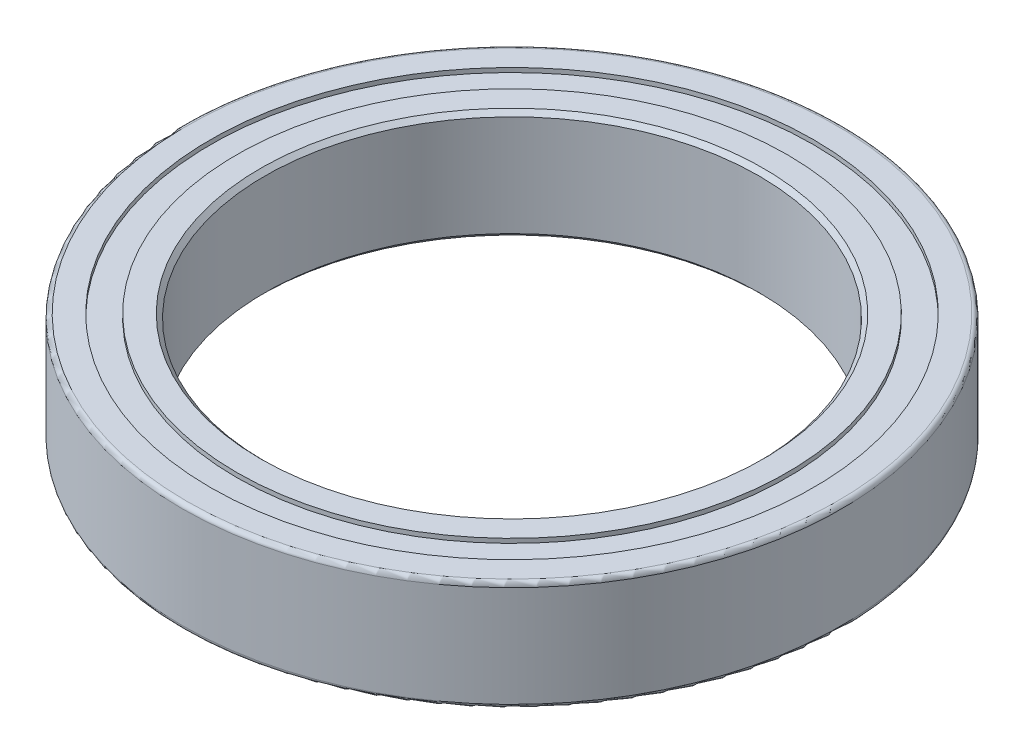
from build123d import *

# Parameters (mm, degrees)
SKETCH1_R             = 9.525
SKETCH1_R_2           = 8.7122
BOSS_EXTRUDE1_DEPTH   = 1.5875
SKETCH1_R_3           = 7.95655
SKETCH1_R_4           = 7.14375
BOSS_EXTRUDE1_2_DEPTH = 1.5875
FILLET1_R             = 0.127
CHAMFER1_SIZE         = 0.127
SKETCH2_R             = 8.7122
SKETCH2_R_2           = 7.95655
BOSS_EXTRUDE2_DEPTH   = 1.4605


with BuildPart() as part:
    # Sketch1 → Boss-Extrude1 (new, symmetric)
    with BuildSketch(Plane(origin=(0, 0, 0), x_dir=(1, 0, 0), z_dir=(0, 1, 0))):
        with Locations(Location((0, 0, 0), (0, 0, 270))):
            Circle(SKETCH1_R)
        with Locations(Location((0, 0, 0), (0, 0, 270))):
            Circle(SKETCH1_R_2, mode=Mode.SUBTRACT)
    extrude(amount=BOSS_EXTRUDE1_DEPTH, both=True)

    # Fillet1
    fillet1_edges = [part.edges().sort_by_distance(p)[0] for p in [
        (0, 1.5875, -9.525),
        (0, -1.5875, -9.525),
    ]]
    fillet(fillet1_edges, radius=FILLET1_R)



with BuildPart() as body_2:
    # Sketch1 → Boss-Extrude1 2 (new, symmetric)
    with BuildSketch(Plane(origin=(0, 0, 0), x_dir=(1, 0, 0), z_dir=(0, 1, 0))):
        with Locations(Location((0, 0, 0), (0, 0, 270))):
            Circle(SKETCH1_R_3)
        with Locations(Location((0, 0, 0), (0, 0, 270))):
            Circle(SKETCH1_R_4, mode=Mode.SUBTRACT)
    extrude(amount=BOSS_EXTRUDE1_2_DEPTH, both=True)

    # Chamfer1
    chamfer1_edges = [body_2.edges().sort_by_distance(p)[0] for p in [
        (0, -1.5875, -7.14375),
        (0, 1.5875, -7.14375),
    ]]
    chamfer(chamfer1_edges, length=CHAMFER1_SIZE)


with BuildPart() as part_1:
    add(part.part)

    add(body_2.part)  # Boss-Extrude2 merges body 2
    # Sketch2 → Boss-Extrude2 (add, symmetric)
    with BuildSketch(Plane(origin=(0, 0, 0), x_dir=(1, 0, 0), z_dir=(0, 1, 0))):
        with Locations(Location((0, 0, 0), (0, 0, 270))):
            Circle(SKETCH2_R)
        with Locations(Location((0, 0, 0), (0, 0, 270))):
            Circle(SKETCH2_R_2, mode=Mode.SUBTRACT)
    extrude(amount=BOSS_EXTRUDE2_DEPTH, both=True)


solid = part_1.part
